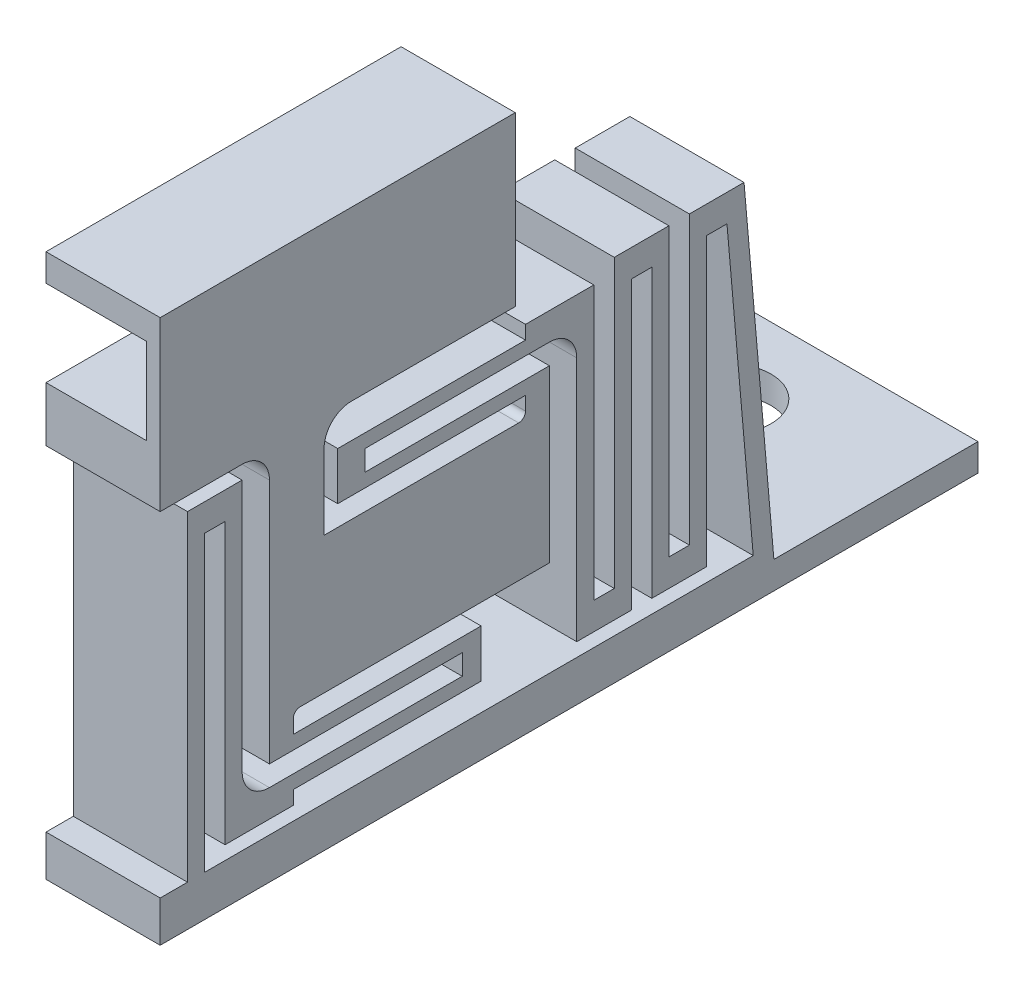
from build123d import *

# Parameters (mm, degrees)
FLEXURE_BOSS_DEPTH            = 4.18
SKETCH2_W                     = 9.5
SKETCH2_H                     = 18
SKETCH2_R                     = 1.575
MOUNTING_PLATE_BOSS_DEPTH     = 1
DOVETAIL_CONNECTION_CUT_DEPTH = 3.68


with BuildPart() as part:
    # Sketch1 → Flexure Boss (new body)
    with BuildSketch(Plane(origin=(0, 0, 0), x_dir=(0, 0, -1), z_dir=(1, 0, 0))):
        with BuildLine():
            Line((2.368651747, -1.066915143), (8.368651984, -1.066915143))
            Line((8.368651984, -1.066915143), (8.368651984, 5.083084857))
            Line((8.368651984, 5.083084857), (-4.631348016, 5.083084857))
            Line((-4.631348016, 5.083084857), (-4.631348016, -1.066915143))
            Line((-4.631348016, -1.066915143), (-1.631348253, -1.066915143))
            ThreePointArc((-1.631348253, -1.066915143), (-0.924241471, -1.359808362), (-0.631348253, -2.066915143))
            Line((-0.631348253, -2.066915143), (-0.631348253, -11.066916497))
            Line((-0.631348253, -11.066916497), (6.427805299, -11.066916497))
            Line((6.427805299, -11.066916497), (6.427805299, -11.816916497))
            Line((6.427805299, -11.816916497), (-0.63134937, -11.816916497))
            ThreePointArc((-0.63134937, -11.816916497), (-1.338456151, -11.524023278), (-1.63134937, -10.816916497))
            Line((-1.63134937, -10.816916497), (-1.63134937, -1.566915143))
            Line((-1.63134937, -1.566915143), (-3.63134937, -1.566915143))
            Line((-3.63134937, -1.566915143), (-3.63134937, -13.316915143))
            Line((-3.63134937, -13.316915143), (-4.631348016, -13.316915143))
            Line((-4.631348016, -13.316915143), (-4.631348016, -14.816915143))
            Line((-4.631348016, -14.816915143), (17.924748705, -14.816915143))
            Line((17.924748705, -14.816915143), (16.743651747, -1.316915143))
            Line((16.743651747, -1.316915143), (14.743651747, -1.316915143))
            Line((14.743651747, -1.316915143), (14.743651747, -11.816915143))
            Line((14.743651747, -11.816915143), (13.993651747, -11.816915143))
            Line((13.993651747, -11.816915143), (13.993651747, -1.316915143))
            Line((13.993651747, -1.316915143), (11.993651747, -1.316915143))
            Line((11.993651747, -1.316915143), (11.993651747, -11.816915143))
            Line((11.993651747, -11.816915143), (11.243651747, -11.816915143))
            Line((11.243651747, -11.816915143), (11.243651747, -1.816915143))
            Line((11.243651747, -1.816915143), (8.743651747, -1.816915143))
            Line((8.743651747, -1.816915143), (8.743651747, -2.316915143))
            Line((8.743651747, -2.316915143), (1.868651747, -2.316915143))
            Line((1.868651747, -2.316915143), (1.868651747, -4.066915143))
            Line((1.868651747, -4.066915143), (8.743651747, -4.066915143))
            Line((8.743651747, -4.066915143), (8.743651747, -4.566915143))
            ThreePointArc((8.743651747, -4.566915143), (8.670428443, -4.743691838), (8.493651747, -4.816915143))
            Line((8.493651747, -4.816915143), (1.368651747, -4.816915143))
            Line((1.368651747, -4.816915143), (1.368651747, -2.066915143))
            ThreePointArc((1.368651747, -2.066915143), (1.661544966, -1.359808362), (2.368651747, -1.066915143))
        make_face()
        with BuildLine():
            Line((0.493651747, -9.816916497), (9.618651747, -9.816916497))
            Line((9.618651747, -9.816916497), (9.618651747, -3.566915143))
            Line((9.618651747, -3.566915143), (2.868650393, -3.566915143))
            Line((2.868650393, -3.566915143), (2.868650393, -2.816915143))
            Line((2.868650393, -2.816915143), (9.618651747, -2.816915143))
            ThreePointArc((9.618651747, -2.816915143), (10.325758529, -3.109808362), (10.618651747, -3.816915143))
            Line((10.618651747, -3.816915143), (10.618651747, -12.816913789))
            Line((10.618651747, -12.816913789), (12.618651747, -12.816913789))
            Line((12.618651747, -12.816913789), (12.618651747, -2.316912435))
            Line((12.618651747, -2.316912435), (13.368651747, -2.316912435))
            Line((13.368651747, -2.316912435), (13.368651747, -12.816913789))
            Line((13.368651747, -12.816913789), (15.368651747, -12.816913789))
            Line((15.368651747, -12.816913789), (15.368651747, -2.316912435))
            Line((15.368651747, -2.316912435), (16.118651747, -2.316912435))
            Line((16.118651747, -2.316912435), (17.081027283, -13.316915143))
            Line((17.081027283, -13.316915143), (-3.00634937, -13.316915143))
            Line((-3.00634937, -13.316915143), (-3.00634937, -2.566915143))
            Line((-3.00634937, -2.566915143), (-2.25634937, -2.566915143))
            Line((-2.25634937, -2.566915143), (-2.25634937, -12.816916497))
            Line((-2.25634937, -12.816916497), (0.24365063, -12.816916497))
            Line((0.24365063, -12.816916497), (0.24365063, -12.316916497))
            Line((0.24365063, -12.316916497), (7.11865063, -12.316916497))
            Line((7.11865063, -12.316916497), (7.11865063, -10.566916497))
            Line((7.11865063, -10.566916497), (0.243651747, -10.566916497))
            Line((0.243651747, -10.566916497), (0.243651747, -10.066916497))
            ThreePointArc((0.243651747, -10.066916497), (0.316875052, -9.890139802), (0.493651747, -9.816916497))
        make_face(mode=Mode.SUBTRACT)
    extrude(amount=FLEXURE_BOSS_DEPTH)

    # Sketch2 → Mounting Plate Boss (add)
    with BuildSketch(Plane.XZ.offset(14.816915143)):
        with Locations((-0.57, -16.309568548)):
            Rectangle(SKETCH2_W, SKETCH2_H)
        with Locations(Location((-1.75, -10.088651984, 0), (0, 0, 270))):
            Circle(SKETCH2_R, mode=Mode.SUBTRACT)
        with Locations(Location((-1.75, -22.088651984, 0), (0, 0, 270))):
            Circle(SKETCH2_R, mode=Mode.SUBTRACT)
    extrude(amount=-MOUNTING_PLATE_BOSS_DEPTH)

    # Sketch7 → Dovetail Connection Cut (cut)
    with BuildSketch(Plane.ZY):
        Polygon((-8.368651984, 0.933084857), (4.631348016, 0.933084857), (4.631348016, 4.083084857), (-1.868651984, 3.083084857), (-8.368651984, 4.083084857), align=None)
    extrude(amount=-DOVETAIL_CONNECTION_CUT_DEPTH, mode=Mode.SUBTRACT)


solid = part.part
